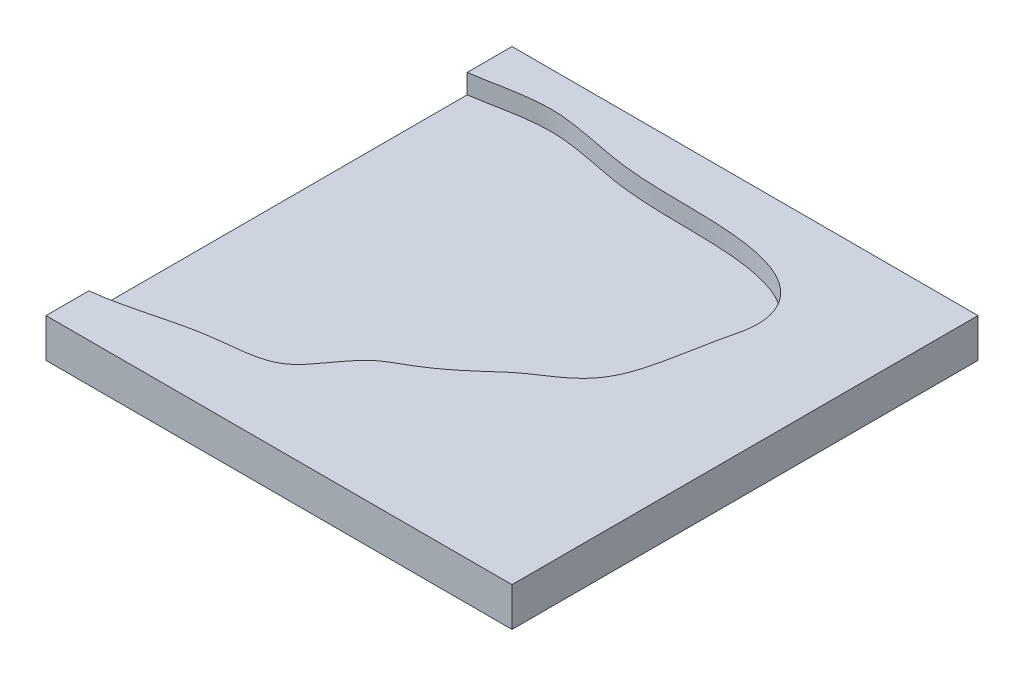
from build123d import *

# Parameters (mm, degrees)
SCHIZZO2_W                   = 120
SCHIZZO2_H                   = 120
ESTRUSIONE_ESTRUSIONE2_DEPTH = 10
TAGLIO_ESTRUSIONE1_DEPTH     = 5
FORO_PER_VITE_M2_5_2_D       = 3.1
FORO_PER_VITE_M2_5_2_DEPTH   = 4
FORO_PER_VITE_M2_5_2_TIP     = 0.931333959


with BuildPart() as part:
    # Schizzo2 → Estrusione-Estrusione2 (new body)
    with BuildSketch(Plane(origin=(0, 0, 0), x_dir=(1, 0, 0), z_dir=(0, 1, 0))):
        with Locations((57.336140445, -89.689917766)):
            Rectangle(SCHIZZO2_W, SCHIZZO2_H)
    extrude(amount=ESTRUSIONE_ESTRUSIONE2_DEPTH)

    # Schizzo3 → Taglio-Estrusione1 (cut)
    with BuildSketch(Plane(origin=(0, 10, 0), x_dir=(1, 0, 0), z_dir=(0, 1, 0))):
        with BuildLine():
            Line((-2.663859555, -41.221032808), (-2.663859555, -138.643920272))
            add(Edge.make_bspline(
                [(-2.663859555, -41.221032808), (3.353453487, -40.416646042), (16.340457254, -36.675476812), (38.910501362, -43.235816996), (63.335822523, -41.948555632), (86.602392347, -45.377590215), (92.061905469, -58.175628156), (88.277693124, -72.156151016), (85.643137691, -94.590278544), (74.339105676, -98.395322843), (64.976553317, -106.817997229), (59.257506312, -111.938966377), (46.950934572, -118.429256318), (41.01599655, -130.652416152), (33.034149123, -132.147753259), (16.009832786, -133.868551103), (5.75694627, -137.747753924), (-2.663859555, -138.643920272)],
                knots=[0, 0, 0, 0, 0.094415624, 0.184087983, 0.301355615, 0.426619626, 0.503602752, 0.520543902, 0.596031123, 0.700435041, 0.720928373, 0.792071547, 0.806901849, 0.860338501, 0.916687335, 0.930653485, 1, 1, 1, 1], degree=3))
        make_face()
    extrude(amount=-TAGLIO_ESTRUSIONE1_DEPTH, mode=Mode.SUBTRACT)

    # Foro per Vite M2.5-2
    with Locations(Plane(origin=(57.336140445, 0, 69.689917766), x_dir=(0, 0, -1), z_dir=(0, -1, 0))):
        with Locations((0, 0), (-40, 0)):
            Hole(FORO_PER_VITE_M2_5_2_D / 2, depth=FORO_PER_VITE_M2_5_2_DEPTH)
            with Locations((0, 0, -(FORO_PER_VITE_M2_5_2_DEPTH + FORO_PER_VITE_M2_5_2_TIP / 2))):  # 118° drill point
                Cone(0, FORO_PER_VITE_M2_5_2_D / 2, FORO_PER_VITE_M2_5_2_TIP, mode=Mode.SUBTRACT)


solid = part.part
